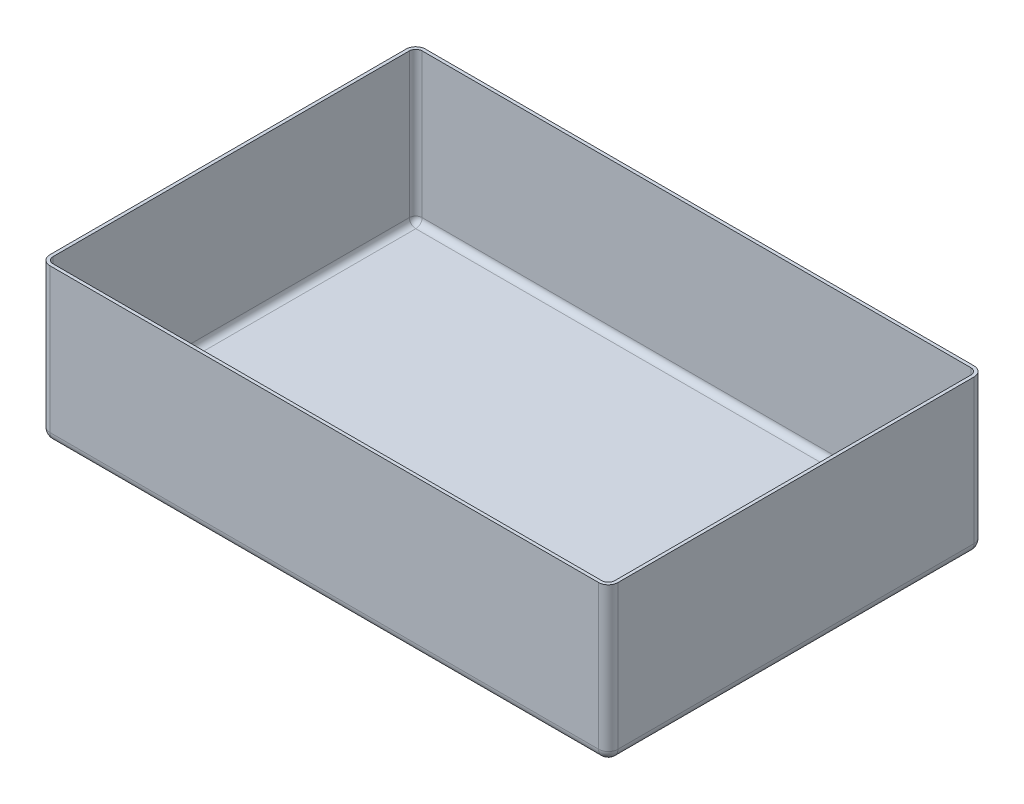
from build123d import *

# Parameters (mm, degrees)
SKETCH1_W           = 177
SKETCH1_H           = 117
BOSS_EXTRUDE1_DEPTH = 48
FILLET2_R           = 3
SHELL1_T            = -1


with BuildPart() as part:
    # Sketch1 → Boss-Extrude1 (new body)
    with BuildSketch(Plane(origin=(0, 0, 0), x_dir=(1, 0, 0), z_dir=(0, 1, 0))):
        with Locations((22.251787948, -23.4158877)):
            Rectangle(SKETCH1_W, SKETCH1_H)
    extrude(amount=BOSS_EXTRUDE1_DEPTH)

    # Fillet2
    fillet2_edges = [part.edges().sort_by_distance(p)[0] for p in [
        (22.251787948, 0, -35.0841123),
        (110.751787948, 0, 23.4158877),
        (22.251787948, 0, 81.9158877),
        (-66.248212052, 0, 23.4158877),
        (-66.248212052, 24, -35.0841123),
        (110.751787948, 24, -35.0841123),
        (110.751787948, 24, 81.9158877),
        (-66.248212052, 24, 81.9158877),
    ]]
    fillet(fillet2_edges, radius=FILLET2_R)

    # Shell1
    shell1_openings = [part.faces().sort_by_distance(p)[0] for p in [
        (22.251787948, 48, 23.4158877),
    ]]
    offset(amount=SHELL1_T, openings=shell1_openings, kind=Kind.INTERSECTION)


solid = part.part
